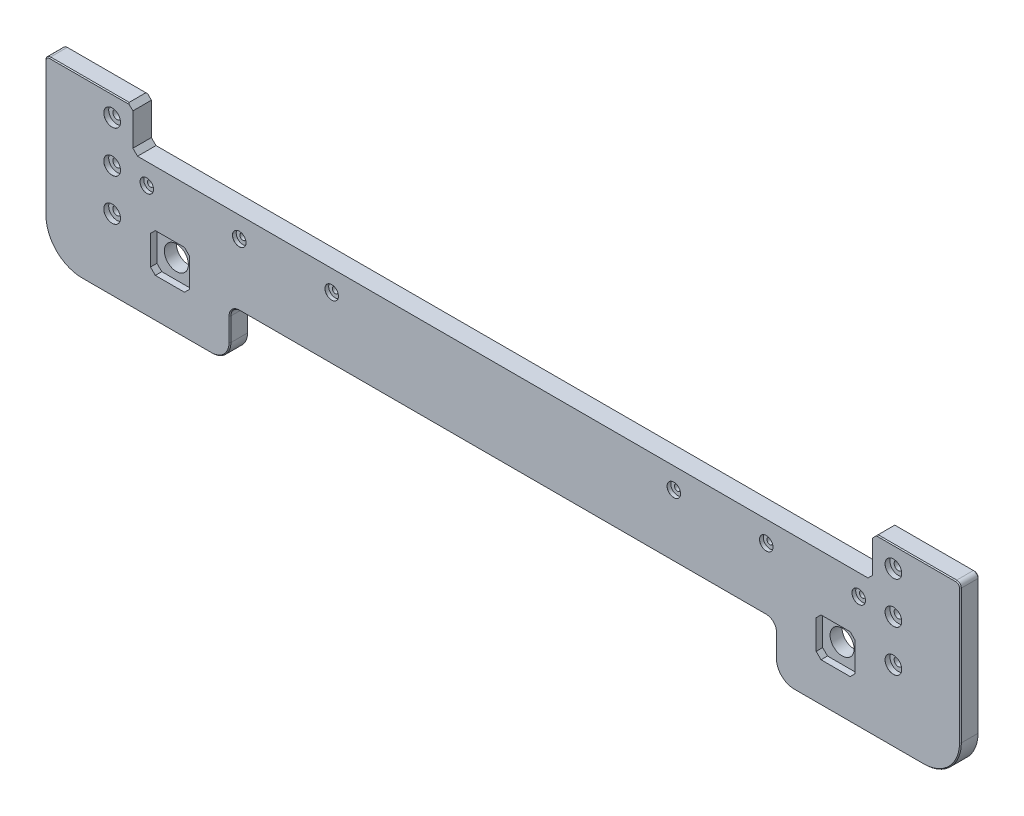
from build123d import *

# Parameters (mm, degrees)
BOSS_EXTRUDE1_DEPTH                    = 20
CBORE_FOR_M8_HEX_HEAD_BOLT1_AT_2_COUNT = 2
CBORE_FOR_M8_HEX_HEAD_BOLT1_AT_2_PITCH = 45
CBORE_FOR_M8_HEX_HEAD_BOLT1_AT_3_COUNT = 2
CBORE_FOR_M8_HEX_HEAD_BOLT1_AT_3_PITCH = 1307.399809271
CBORE_FOR_M8_HEX_HEAD_BOLT1_AT_4_COUNT = 2
CBORE_FOR_M8_HEX_HEAD_BOLT1_AT_4_PITCH = 90
CBORE_FOR_M6_HEX_HEAD_BOLT1_AT_2_COUNT = 2
CBORE_FOR_M6_HEX_HEAD_BOLT1_AT_2_PITCH = 100
CBORE_FOR_M6_HEX_HEAD_BOLT1_AT_3_COUNT = 2
CBORE_FOR_M6_HEX_HEAD_BOLT1_AT_3_PITCH = 199.997125624
CHAMFER1_SIZE                          = 1
CHAMFER2_SIZE                          = 1
CUT_EXTRUDE14_DEPTH                    = 7
SKETCH49_R                             = 13
CUT_EXTRUDE15_DEPTH                    = 529.16388983
FILLET1_SIZE                           = 5


with BuildPart() as part:
    # Sketch1 → Boss-Extrude1 (new body)
    with BuildSketch(Plane.XY):
        with BuildLine():
            Line((-495, 33.117706736), (-495, 178.117706736))
            ThreePointArc((-495, 178.117706736), (-493.535533906, 181.653240642), (-490, 183.117706736))
            Line((-490, 183.117706736), (-400, 183.117706736))
            Line((-400, 183.117706736), (-400, 138.117706736))
            Line((-400, 138.117706736), (0, 138.117706736))
            Line((0, 138.117706736), (400, 138.117706736))
            Line((400, 138.117706736), (400, 183.117706736))
            Line((400, 183.117706736), (490, 183.117706736))
            ThreePointArc((490, 183.117706736), (493.535533906, 181.653240642), (495, 178.117706736))
            Line((495, 178.117706736), (495, 33.117706736))
            ThreePointArc((495, 33.117706736), (483.284271247, 4.833435489), (455, -6.882293264))
            Line((455, -6.882293264), (315, -6.882293264))
            ThreePointArc((315, -6.882293264), (300.857864376, -1.024428888), (295, 13.117706736))
            Line((295, 13.117706736), (295, 38.117706736))
            ThreePointArc((295, 38.117706736), (292.071067812, 45.188774548), (285, 48.117706736))
            Line((285, 48.117706736), (-285, 48.117706736))
            ThreePointArc((-285, 48.117706736), (-292.071067812, 45.188774548), (-295, 38.117706736))
            Line((-295, 38.117706736), (-295, 13.117706736))
            ThreePointArc((-295, 13.117706736), (-300.857864376, -1.024428888), (-315, -6.882293264))
            Line((-315, -6.882293264), (-455, -6.882293264))
            ThreePointArc((-455, -6.882293264), (-483.284271247, 4.833435489), (-495, 33.117706736))
        make_face()
    extrude(amount=BOSS_EXTRUDE1_DEPTH)

    # Sketch6 → CBORE for M8 Hex Head Bolt1 (revolve, cut)
    with BuildSketch(Plane(origin=(-422.5, 160.617706736, 20), x_dir=(0, -1, 0), z_dir=(1, 0, 0))):
        Polygon((0, 0), (0, 20), (4.5, 20), (4.5, 5.3), (9.0055, 5.3), (9.0055, 0.025), (9.0305, 0), align=None)
    cbore_for_m8_hex_head_bolt1 = revolve(axis=Axis((-422.5, 160.617706736, 26.35), (0, 0, -1)), mode=Mode.SUBTRACT)

    # CBORE for M8 Hex Head Bolt1 at 2: CBORE for M8 Hex Head Bolt1 ×2
    with Locations(*[(0, -i * CBORE_FOR_M8_HEX_HEAD_BOLT1_AT_2_PITCH, 0) for i in range(1, CBORE_FOR_M8_HEX_HEAD_BOLT1_AT_2_COUNT)]):
        add(cbore_for_m8_hex_head_bolt1, mode=Mode.SUBTRACT)

    # CBORE for M8 Hex Head Bolt1 at 3: CBORE for M8 Hex Head Bolt1 ×2
    with Locations(*[Vector(-0.7034023303245859, 0.710791925737724, 0) * (i * CBORE_FOR_M8_HEX_HEAD_BOLT1_AT_3_PITCH) for i in range(1, CBORE_FOR_M8_HEX_HEAD_BOLT1_AT_3_COUNT)]):
        add(cbore_for_m8_hex_head_bolt1, mode=Mode.SUBTRACT)

    # CBORE for M8 Hex Head Bolt1 at 4: CBORE for M8 Hex Head Bolt1 ×2
    with Locations(*[(0, -i * CBORE_FOR_M8_HEX_HEAD_BOLT1_AT_4_PITCH, 0) for i in range(1, CBORE_FOR_M8_HEX_HEAD_BOLT1_AT_4_COUNT)]):
        add(cbore_for_m8_hex_head_bolt1, mode=Mode.SUBTRACT)

    # Mirror1: CBORE for M8 Hex Head Bolt1 across plane
    add(cbore_for_m8_hex_head_bolt1.mirror(Plane(origin=(0, 0, 0), x_dir=(0, 0, 1), z_dir=(1, 0, 0))), mode=Mode.SUBTRACT)

    # Mirror1 copy 1 sketch → Mirror1 copy 1 (revolve, cut)
    with BuildSketch(Plane(origin=(422.5, 115.617706736, 20), x_dir=(0, -1, 0), z_dir=(-1, 0, 0))):
        Polygon((0, 0), (0, -20), (4.5, -20), (4.5, -5.3), (9.0055, -5.3), (9.0055, -0.025), (9.0305, 0), align=None)
    revolve(axis=Axis((422.5, 115.617706736, 26.35), (0, 0, 1)), mode=Mode.SUBTRACT)

    # Mirror1 copy 2 sketch → Mirror1 copy 2 (revolve, cut)
    with BuildSketch(Plane(origin=(1342.128072507, 1089.906934877, 20), x_dir=(0, -1, 0), z_dir=(-1, 0, 0))):
        Polygon((0, 0), (0, -20), (4.5, -20), (4.5, -5.3), (9.0055, -5.3), (9.0055, -0.025), (9.0305, 0), align=None)
    revolve(axis=Axis((1342.128072507, 1089.906934877, 26.35), (0, 0, 1)), mode=Mode.SUBTRACT)

    # Mirror1 copy 3 sketch → Mirror1 copy 3 (revolve, cut)
    with BuildSketch(Plane(origin=(422.5, 70.617706736, 20), x_dir=(0, -1, 0), z_dir=(-1, 0, 0))):
        Polygon((0, 0), (0, -20), (4.5, -20), (4.5, -5.3), (9.0055, -5.3), (9.0055, -0.025), (9.0305, 0), align=None)
    revolve(axis=Axis((422.5, 70.617706736, 26.35), (0, 0, 1)), mode=Mode.SUBTRACT)

    # Sketch8 → CBORE for M6 Hex Head Bolt1 (revolve, cut)
    with BuildSketch(Plane(origin=(-385, 115.617706736, 20), x_dir=(0, -1, 0), z_dir=(1, 0, 0))):
        Polygon((0, 0), (0, 20.001), (3.3, 20.001), (3.3, 4), (7.2735, 4), (7.2735, 0.025), (7.2985, 0), align=None)
    cbore_for_m6_hex_head_bolt1 = revolve(axis=Axis((-385, 115.617706736, 26.35), (0, 0, -1)), mode=Mode.SUBTRACT)

    # CBORE for M6 Hex Head Bolt1 at 2: CBORE for M6 Hex Head Bolt1 ×2
    with Locations(*[(i * CBORE_FOR_M6_HEX_HEAD_BOLT1_AT_2_PITCH, 0, 0) for i in range(1, CBORE_FOR_M6_HEX_HEAD_BOLT1_AT_2_COUNT)]):
        add(cbore_for_m6_hex_head_bolt1, mode=Mode.SUBTRACT)

    # CBORE for M6 Hex Head Bolt1 at 3: CBORE for M6 Hex Head Bolt1 ×2
    with Locations(*[(i * CBORE_FOR_M6_HEX_HEAD_BOLT1_AT_3_PITCH, 0, 0) for i in range(1, CBORE_FOR_M6_HEX_HEAD_BOLT1_AT_3_COUNT)]):
        add(cbore_for_m6_hex_head_bolt1, mode=Mode.SUBTRACT)

    # Mirror2: CBORE for M6 Hex Head Bolt1 across plane
    add(cbore_for_m6_hex_head_bolt1.mirror(Plane(origin=(0, 0, 0), x_dir=(0, 0, 1), z_dir=(1, 0, 0))), mode=Mode.SUBTRACT)

    # Mirror2 copy 1 sketch → Mirror2 copy 1 (revolve, cut)
    with BuildSketch(Plane(origin=(285, 115.617706736, 20), x_dir=(0, -1, 0), z_dir=(-1, 0, 0))):
        Polygon((0, 0), (0, -20.001), (3.3, -20.001), (3.3, -4), (7.2735, -4), (7.2735, -0.025), (7.2985, 0), align=None)
    revolve(axis=Axis((285, 115.617706736, 26.35), (0, 0, 1)), mode=Mode.SUBTRACT)

    # Mirror2 copy 2 sketch → Mirror2 copy 2 (revolve, cut)
    with BuildSketch(Plane(origin=(185.002874376, 115.617706736, 20), x_dir=(0, -1, 0), z_dir=(-1, 0, 0))):
        Polygon((0, 0), (0, -20.001), (3.3, -20.001), (3.3, -4), (7.2735, -4), (7.2735, -0.025), (7.2985, 0), align=None)
    revolve(axis=Axis((185.002874376, 115.617706736, 26.35), (0, 0, 1)), mode=Mode.SUBTRACT)

    # Chamfer1
    chamfer1_edges = [part.edges().sort_by_distance(p)[0] for p in [
        (292.071067812, 45.188774548, 20),
        (295, 25.617706736, 20),
        (300.857864376, -1.024428888, 20),
        (385, -6.882293264, 20),
        (483.284271247, 4.833435489, 20),
        (495, 105.617706736, 20),
        (493.535533906, 181.653240642, 20),
        (445, 183.117706736, 20),
        (-292.071067812, 45.188774548, 20),
        (-445, 183.117706736, 20),
        (-493.535533906, 181.653240642, 20),
        (-495, 105.617706736, 20),
        (-483.284271247, 4.833435489, 20),
        (-385, -6.882293264, 20),
        (-300.857864376, -1.024428888, 20),
        (-295, 25.617706736, 20),
        (0, 48.117706736, 20),
    ]]
    chamfer(chamfer1_edges, length=CHAMFER1_SIZE)

    # Chamfer2
    chamfer2_edges = [part.edges().sort_by_distance(p)[0] for p in [
        (-295, 25.617706736, 0),
        (-300.857864376, -1.024428888, 0),
        (-385, -6.882293264, 0),
        (-483.284271247, 4.833435489, 0),
        (-495, 105.617706736, 0),
        (-493.535533906, 181.653240642, 0),
        (-445, 183.117706736, 0),
        (445, 183.117706736, 0),
        (493.535533906, 181.653240642, 0),
        (495, 105.617706736, 0),
        (483.284271247, 4.833435489, 0),
        (385, -6.882293264, 0),
        (300.857864376, -1.024428888, 0),
        (295, 25.617706736, 0),
        (292.071067812, 45.188774548, 0),
        (0, 48.117706736, 0),
        (-292.071067812, 45.188774548, 0),
    ]]
    chamfer(chamfer2_edges, length=CHAMFER2_SIZE)

    # Sketch16 → Cut-Extrude14 (cut)
    with BuildSketch(Plane.XY.offset(20)):
        Polygon((-375.773169187, 78.117706736), (-344.229306438, 78.117706736), (-339, 72.886119668), (-339, 41.351758145), (-344.226830813, 36.117706736), (-375.770693562, 36.117706736), (-381, 41.349293804), (-381, 72.883655327), align=None)
    cut_extrude14 = extrude(amount=-CUT_EXTRUDE14_DEPTH, mode=Mode.SUBTRACT)

    # Sketch49 → Cut-Extrude15 (cut, through all)
    with BuildSketch(Plane.XY.offset(20)):
        with Locations((-360, 57.117706736)):
            Circle(SKETCH49_R)
    cut_extrude15 = extrude(amount=-CUT_EXTRUDE15_DEPTH, mode=Mode.SUBTRACT)

    # Mirror3: Cut-Extrude14, Cut-Extrude15 across plane
    add(cut_extrude14.mirror(Plane(origin=(0, 0, 0), x_dir=(0, 0, 1), z_dir=(1, 0, 0))), mode=Mode.SUBTRACT)
    add(cut_extrude15.mirror(Plane(origin=(0, 0, 0), x_dir=(0, 0, 1), z_dir=(1, 0, 0))), mode=Mode.SUBTRACT)

    # Fillet1
    fillet1_edges = [part.edges().sort_by_distance(p)[0] for p in [
        (-400, 138.117706736, 10),
        (-400, 183.117706736, 10),
        (400, 183.117706736, 10),
        (400, 138.117706736, 10),
    ]]
    chamfer(fillet1_edges, length=FILLET1_SIZE)


solid = part.part
